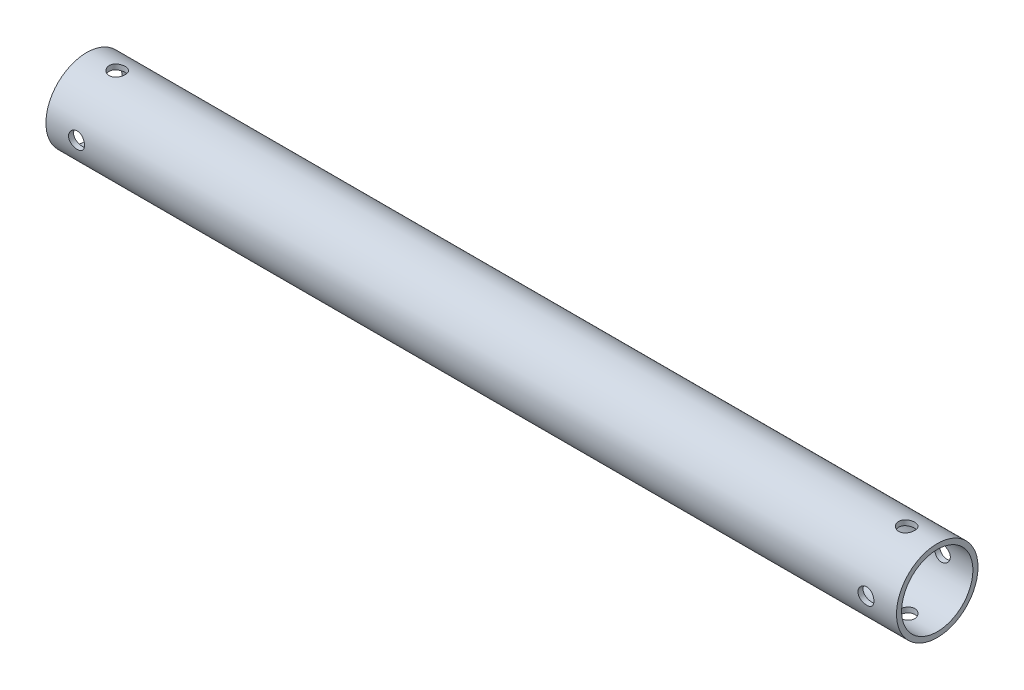
from build123d import *

# Parameters (mm, degrees)
SKETCH1_R               = 12.7
SKETCH1_R_2             = 11.1125
EXTRUDE_THIN1_DEPTH     = 132.55625
CUT_EXTRUDE1_DEPTH      = 134.767482648
CUT_EXTRUDE1_DEPTH_BACK = 134.767482648
SKETCH3_R               = 2.4892
CUT_EXTRUDE2_DEPTH      = 134.767482766
CUT_EXTRUDE2_DEPTH_BACK = 134.767482766
SKETCH4_R               = 2.4892


with BuildPart() as part:
    # Sketch1 → Extrude-Thin1 (new, symmetric)
    with BuildSketch(Plane(origin=(0, 0, 0), x_dir=(0, 0, -1), z_dir=(1, 0, 0))):
        Circle(SKETCH1_R)
        Circle(SKETCH1_R_2, mode=Mode.SUBTRACT)
    extrude(amount=EXTRUDE_THIN1_DEPTH, both=True)

    # Sketch3 → Cut-Extrude1 (cut, two sides: drawn at the far end of the back side and taken through both)
    with BuildSketch(Plane.XY.offset(-CUT_EXTRUDE1_DEPTH_BACK)):
        with Locations((123.03125, 0)):
            Circle(SKETCH3_R)
        with Locations((-123.03125, 0)):
            Circle(SKETCH3_R)
    extrude(amount=CUT_EXTRUDE1_DEPTH + CUT_EXTRUDE1_DEPTH_BACK, mode=Mode.SUBTRACT)

    # Sketch4 → Cut-Extrude2 (cut, two sides: drawn at the far end of the back side and taken through both)
    with BuildSketch(Plane(origin=(0, 0, 0), x_dir=(1, 0, 0), z_dir=(0, 1, 0)).offset(-CUT_EXTRUDE2_DEPTH_BACK)):
        with Locations(Location((123.03125, 0, 0), (0, 0, 270))):
            Circle(SKETCH4_R)
        with Locations(Location((-123.03125, 0, 0), (0, 0, 270))):
            Circle(SKETCH4_R)
    extrude(amount=CUT_EXTRUDE2_DEPTH + CUT_EXTRUDE2_DEPTH_BACK, mode=Mode.SUBTRACT)


solid = part.part
